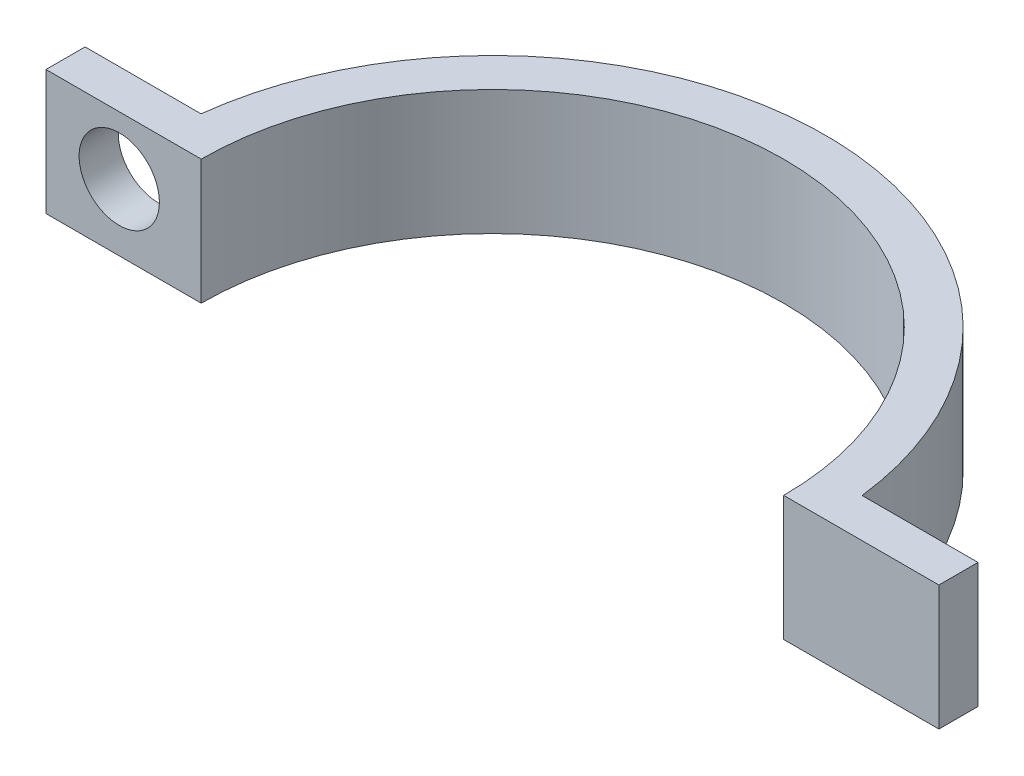
from build123d import *

# Parameters (mm, degrees)
BOSS_EXTRUDE1_DEPTH = 1.5
SKETCH3_R           = 0.482388485
CUT_EXTRUDE1_DEPTH  = 0.47


with BuildPart() as part:
    # Sketch1 → Boss-Extrude1 (new body)
    with BuildSketch(Plane(origin=(0, 0, 0), x_dir=(1, 0, 0), z_dir=(0, 1, 0))):
        with BuildLine():
            Line((5.365482369, 0), (3.5, 0))
            ThreePointArc((3.5, 0), (0, 3.5), (-3.5, 0))
            Line((-3.5, 0), (-5.365482369, 0))
            Line((-5.365482369, 0), (-5.365482369, 0.469939432))
            Line((-5.365482369, 0.469939432), (-3.972298696, 0.469939432))
            ThreePointArc((-3.972298696, 0.469939432), (0, 4), (3.972298696, 0.469939432))
            Line((3.972298696, 0.469939432), (5.365482369, 0.469939432))
            Line((5.365482369, 0.469939432), (5.365482369, 0))
        make_face()
    extrude(amount=BOSS_EXTRUDE1_DEPTH)

    # Sketch3 → Cut-Extrude1 (cut)
    with BuildSketch(Plane.XY):
        with Locations((-4.485222017, 0.798824848)):
            Circle(SKETCH3_R)
    extrude(amount=-CUT_EXTRUDE1_DEPTH, mode=Mode.SUBTRACT)


solid = part.part
